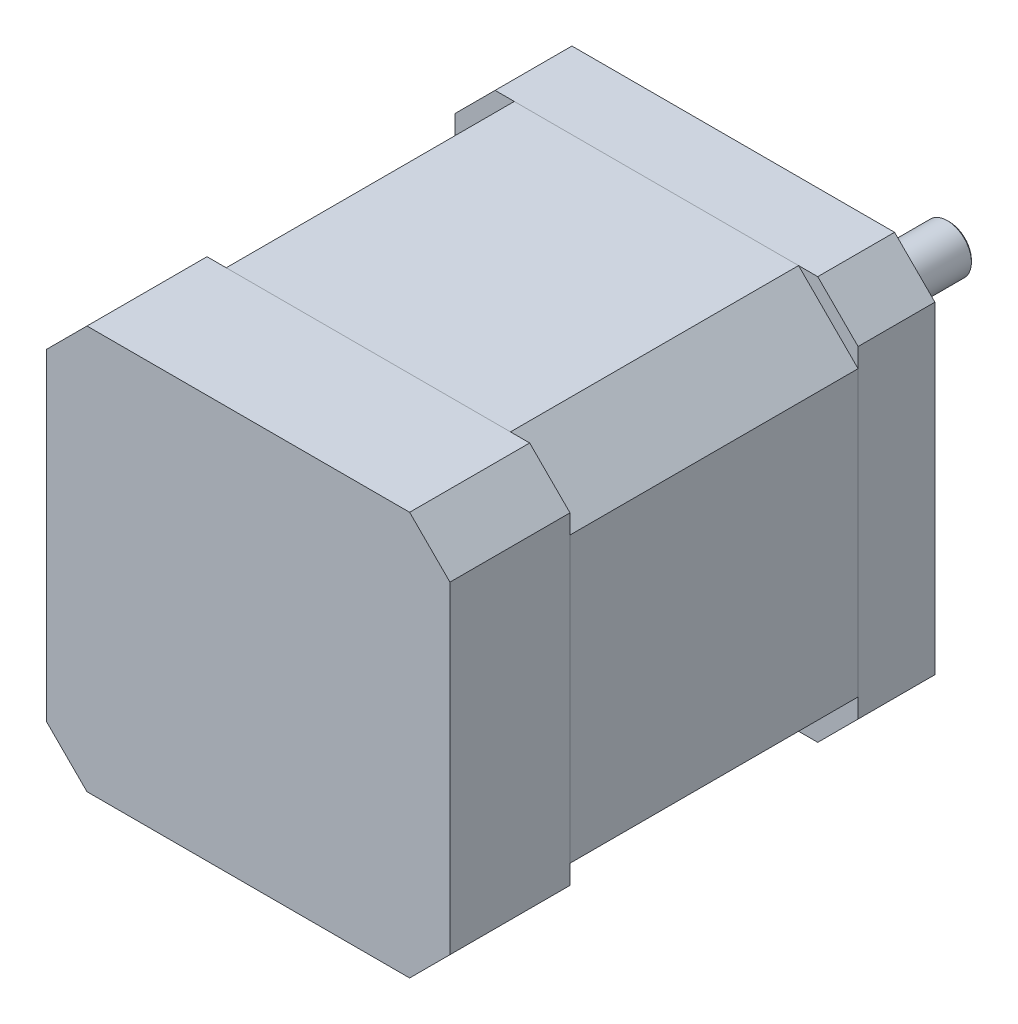
from build123d import *

# Parameters (mm, degrees)
ESQUISSE1_W             = 42
ESQUISSE1_H             = 42
BOSS_EXTRU_1_DEPTH      = 8
CHANFREIN1_SIZE         = 4.2
BOSS_EXTRU_2_DEPTH      = 30
ESQUISSE4_W             = 42
ESQUISSE4_H             = 42
BOSS_EXTRU_3_DEPTH      = 12.5
CHANFREIN3_SIZE         = 4.2
ESQUISSE5_R             = 11
BOSS_EXTRU_4_DEPTH      = 2
ESQUISSE6_R             = 4.5
ENL_V_MAT_EXTRU_1_DEPTH = 3
ESQUISSE7_R             = 2.5
BOSS_EXTRU_5_DEPTH      = 23.5
CHANFREIN4_SIZE         = 0.2
ESQUISSE8_R             = 1.5
ENL_V_MAT_EXTRU_2_DEPTH = 5
CHANFREIN5_SIZE         = 0.2
ESQUISSE9_W             = 7
ESQUISSE9_H             = 8
ENL_V_MAT_EXTRU_3_DEPTH = 2


with BuildPart() as part:
    # Esquisse1 → Boss.-Extru.1 (new body)
    with BuildSketch(Plane.XY):
        Rectangle(ESQUISSE1_W, ESQUISSE1_H)
    extrude(amount=BOSS_EXTRU_1_DEPTH)

    # Chanfrein1
    chanfrein1_edges = [part.edges().sort_by_distance(p)[0] for p in [
        (21, -21, 4),
        (-21, -21, 4),
        (-21, 21, 4),
        (21, 21, 4),
    ]]
    chamfer(chanfrein1_edges, length=CHANFREIN1_SIZE)

    # Esquisse5 → Boss.-Extru.4 (add)
    with BuildSketch(Plane(origin=(0, 0, 0), x_dir=(-1, 0, 0), z_dir=(0, 0, -1))):
        with Locations(Location((0, 0, 0), (0, 0, 180))):
            Circle(ESQUISSE5_R)
    extrude(amount=BOSS_EXTRU_4_DEPTH)

    # Esquisse6 → Enlèv. mat.-Extru.1 (cut)
    with BuildSketch(Plane(origin=(0, 0, -2), x_dir=(-1, 0, 0), z_dir=(0, 0, -1))):
        Circle(ESQUISSE6_R)
    extrude(amount=-ENL_V_MAT_EXTRU_1_DEPTH, mode=Mode.SUBTRACT)

    # Esquisse7 → Boss.-Extru.5 (add)
    with BuildSketch(Plane(origin=(0, 0, 1), x_dir=(-1, 0, 0), z_dir=(0, 0, -1))):
        Circle(ESQUISSE7_R)
    extrude(amount=BOSS_EXTRU_5_DEPTH)

    # Chanfrein4
    chanfrein4_edges = [part.edges().sort_by_distance(p)[0] for p in [
        (2.5, 0, -22.5),
    ]]
    chamfer(chanfrein4_edges, length=CHANFREIN4_SIZE)

    # Esquisse8 → Enlèv. mat.-Extru.2 (cut)
    with BuildSketch(Plane(origin=(0, 0, 0), x_dir=(-1, 0, 0), z_dir=(0, 0, -1))):
        with Locations((-15.5, 15.5)):
            Circle(ESQUISSE8_R)
        with Locations((15.5, 15.5)):
            Circle(ESQUISSE8_R)
        with Locations((15.5, -15.5)):
            Circle(ESQUISSE8_R)
        with Locations((-15.5, -15.5)):
            Circle(ESQUISSE8_R)
    extrude(amount=-ENL_V_MAT_EXTRU_2_DEPTH, mode=Mode.SUBTRACT)

    # Chanfrein5
    chanfrein5_edges = [part.edges().sort_by_distance(p)[0] for p in [
        (17, 15.5, 0),
        (-14, 15.5, 0),
        (-14, -15.5, 0),
        (17, -15.5, 0),
    ]]
    chamfer(chanfrein5_edges, length=CHANFREIN5_SIZE)


with BuildPart() as body_2:
    # Esquisse3 → Boss.-Extru.2 (new body)
    with BuildSketch(Plane.XY.offset(8)):
        Polygon((-21, 14.8), (-14.8, 21), (14.8, 21), (21, 14.8), (21, -14.8), (14.8, -21), (-14.8, -21), (-21, -14.8), align=None)
    extrude(amount=BOSS_EXTRU_2_DEPTH)


with BuildPart() as body_3:
    # Esquisse4 → Boss.-Extru.3 (new body)
    with BuildSketch(Plane.XY.offset(38)):
        Rectangle(ESQUISSE4_W, ESQUISSE4_H)
    extrude(amount=BOSS_EXTRU_3_DEPTH)

    # Chanfrein3
    chanfrein3_edges = [body_3.edges().sort_by_distance(p)[0] for p in [
        (21, -21, 44.25),
        (-21, -21, 44.25),
        (-21, 21, 44.25),
        (21, 21, 44.25),
    ]]
    chamfer(chanfrein3_edges, length=CHANFREIN3_SIZE)

    # Esquisse9 → Enlèv. mat.-Extru.3 (cut)
    with BuildSketch(Plane.ZY.offset(21)):
        with Locations((41.5, 0)):
            Rectangle(ESQUISSE9_W, ESQUISSE9_H)
    extrude(amount=-ENL_V_MAT_EXTRU_3_DEPTH, mode=Mode.SUBTRACT)


solid = Compound([part.part, body_2.part, body_3.part])
